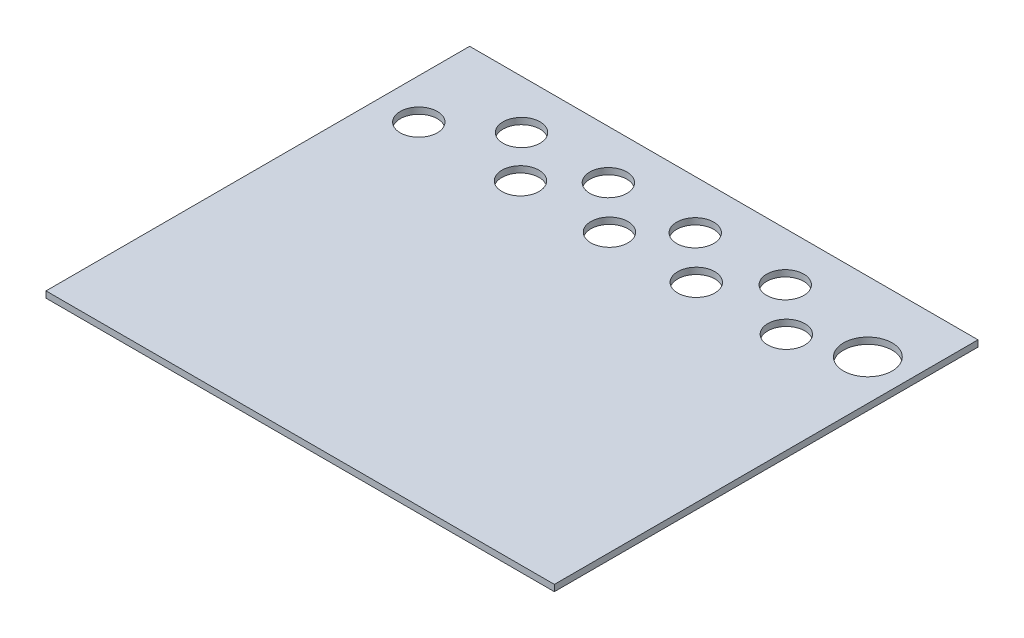
from build123d import *

# Parameters (mm, degrees)
SKETCH1_W             = 240
SKETCH1_H             = 200
BOSS_EXTRUDE1_DEPTH   = 3
M16_CLEARANCE_HOLE1_D = 17.5
M22_CLEARANCE_HOLE1_D = 23


with BuildPart() as part:
    # Sketch1 → Boss-Extrude1 (new body)
    with BuildSketch(Plane(origin=(0, 0, 0), x_dir=(1, 0, 0), z_dir=(0, 1, 0))):
        with Locations((120, 100)):
            Rectangle(SKETCH1_W, SKETCH1_H)
    extrude(amount=BOSS_EXTRUDE1_DEPTH)

    # M16 Clearance Hole1 (through all)
    with Locations(Plane(origin=(0, 3, 0), x_dir=(1, 0, 0), z_dir=(0, 1, 0))):
        with Locations((19, 157), (47.5, 177), (67, 157), (88.5, 177), (109, 157), (129.5, 177), (150, 157), (172, 177), (192.5, 157)):
            Hole(M16_CLEARANCE_HOLE1_D / 2)

    # M22 Clearance Hole1 (through all)
    with Locations(Plane(origin=(0, 3, 0), x_dir=(1, 0, 0), z_dir=(0, 1, 0))):
        with Locations((221, 167)):
            Hole(M22_CLEARANCE_HOLE1_D / 2)


solid = part.part
